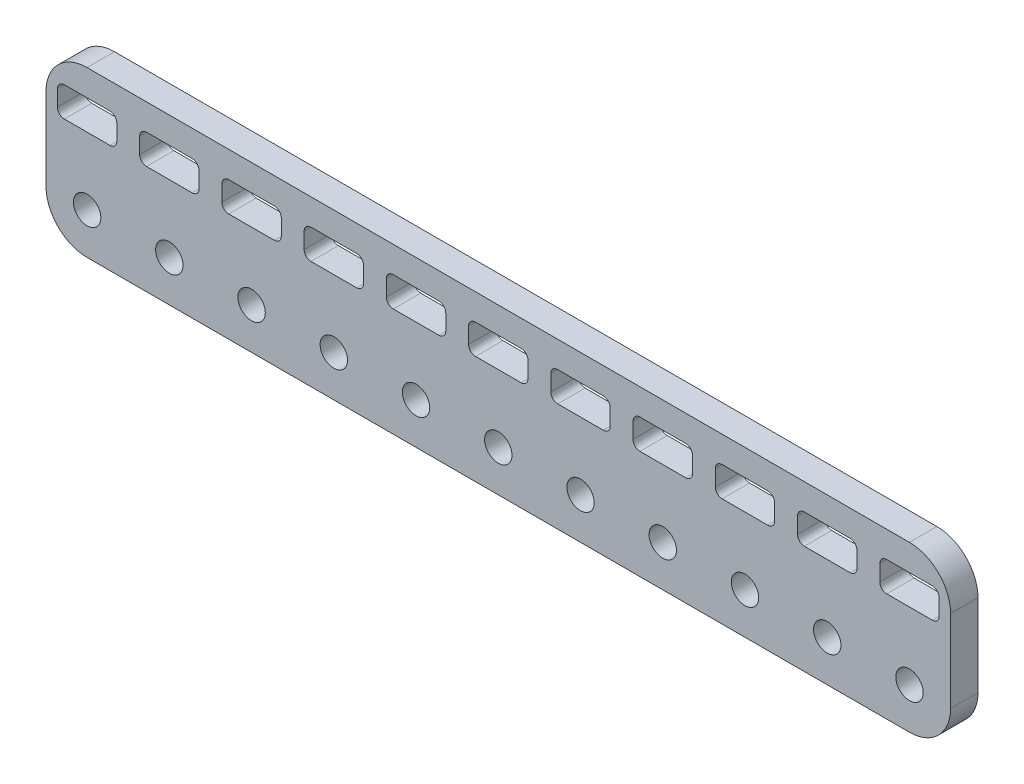
from build123d import *

# Parameters (mm, degrees)
MODEL_R                 = 1.5
SALIENTE_EXTRUIR1_DEPTH = 3


with BuildPart() as part:
    # Model → Saliente-Extruir1 (new body)
    with BuildSketch(Plane.XY):
        with BuildLine():
            Line((256.429131311, 228.742243614), (346.429131311, 228.742243614))
            ThreePointArc((346.429131311, 228.742243614), (349.611111826, 227.424224129), (350.929131311, 224.242243614))
            Line((350.929131311, 224.242243614), (350.929131311, 215.242243614))
            ThreePointArc((350.929131311, 215.242243614), (349.611111826, 212.060263099), (346.429131311, 210.742243614))
            Line((346.429131311, 210.742243614), (256.429131311, 210.742243614))
            ThreePointArc((256.429131311, 210.742243614), (253.247150795, 212.060263099), (251.929131311, 215.242243614))
            Line((251.929131311, 215.242243614), (251.929131311, 224.242243614))
            ThreePointArc((251.929131311, 224.242243614), (253.247150795, 227.424224129), (256.429131311, 228.742243614))
        make_face()
        with Locations((337.429131311, 215.242243614)):
            Circle(MODEL_R, mode=Mode.SUBTRACT)
        with Locations((319.429131311, 215.242243614)):
            Circle(MODEL_R, mode=Mode.SUBTRACT)
        with Locations((328.429131311, 215.242243614)):
            Circle(MODEL_R, mode=Mode.SUBTRACT)
        with Locations((310.429131311, 215.242243614)):
            Circle(MODEL_R, mode=Mode.SUBTRACT)
        with Locations((292.429131311, 215.242243614)):
            Circle(MODEL_R, mode=Mode.SUBTRACT)
        with Locations((301.429131311, 215.242243614)):
            Circle(MODEL_R, mode=Mode.SUBTRACT)
        with Locations((274.429131311, 215.242243614)):
            Circle(MODEL_R, mode=Mode.SUBTRACT)
        with Locations((283.429131311, 215.242243614)):
            Circle(MODEL_R, mode=Mode.SUBTRACT)
        with Locations((265.429131311, 215.242243614)):
            Circle(MODEL_R, mode=Mode.SUBTRACT)
        with Locations((256.429131311, 215.242243614)):
            Circle(MODEL_R, mode=Mode.SUBTRACT)
        with Locations((346.429131311, 215.242243614)):
            Circle(MODEL_R, mode=Mode.SUBTRACT)
        with BuildLine():
            Line((267.929131311, 222.617243614), (262.929131311, 222.617243614))
            ThreePointArc((262.929131311, 222.617243614), (262.398801225, 222.836913528), (262.179131311, 223.367243614))
            Line((262.179131311, 223.367243614), (262.179131311, 225.117243614))
            ThreePointArc((262.179131311, 225.117243614), (262.398801225, 225.6475737), (262.929131311, 225.867243614))
            Line((262.929131311, 225.867243614), (267.929131311, 225.867243614))
            ThreePointArc((267.929131311, 225.867243614), (268.459461397, 225.6475737), (268.679131311, 225.117243614))
            Line((268.679131311, 225.117243614), (268.679131311, 223.367243614))
            ThreePointArc((268.679131311, 223.367243614), (268.459461397, 222.836913528), (267.929131311, 222.617243614))
        make_face(mode=Mode.SUBTRACT)
        with BuildLine():
            Line((285.929131311, 222.617243614), (280.929131311, 222.617243614))
            ThreePointArc((280.929131311, 222.617243614), (280.398801225, 222.836913528), (280.179131311, 223.367243614))
            Line((280.179131311, 223.367243614), (280.179131311, 225.117243614))
            ThreePointArc((280.179131311, 225.117243614), (280.398801225, 225.6475737), (280.929131311, 225.867243614))
            Line((280.929131311, 225.867243614), (285.929131311, 225.867243614))
            ThreePointArc((285.929131311, 225.867243614), (286.459461397, 225.6475737), (286.679131311, 225.117243614))
            Line((286.679131311, 225.117243614), (286.679131311, 223.367243614))
            ThreePointArc((286.679131311, 223.367243614), (286.459461397, 222.836913528), (285.929131311, 222.617243614))
        make_face(mode=Mode.SUBTRACT)
        with BuildLine():
            Line((276.929131311, 222.617243614), (271.929131311, 222.617243614))
            ThreePointArc((271.929131311, 222.617243614), (271.398801225, 222.836913528), (271.179131311, 223.367243614))
            Line((271.179131311, 223.367243614), (271.179131311, 225.117243614))
            ThreePointArc((271.179131311, 225.117243614), (271.398801225, 225.6475737), (271.929131311, 225.867243614))
            Line((271.929131311, 225.867243614), (276.929131311, 225.867243614))
            ThreePointArc((276.929131311, 225.867243614), (277.459461397, 225.6475737), (277.679131311, 225.117243614))
            Line((277.679131311, 225.117243614), (277.679131311, 223.367243614))
            ThreePointArc((277.679131311, 223.367243614), (277.459461397, 222.836913528), (276.929131311, 222.617243614))
        make_face(mode=Mode.SUBTRACT)
        with BuildLine():
            Line((294.929131311, 222.617243614), (289.929131311, 222.617243614))
            ThreePointArc((289.929131311, 222.617243614), (289.398801225, 222.836913528), (289.179131311, 223.367243614))
            Line((289.179131311, 223.367243614), (289.179131311, 225.117243614))
            ThreePointArc((289.179131311, 225.117243614), (289.398801225, 225.6475737), (289.929131311, 225.867243614))
            Line((289.929131311, 225.867243614), (294.929131311, 225.867243614))
            ThreePointArc((294.929131311, 225.867243614), (295.459461397, 225.6475737), (295.679131311, 225.117243614))
            Line((295.679131311, 225.117243614), (295.679131311, 223.367243614))
            ThreePointArc((295.679131311, 223.367243614), (295.459461397, 222.836913528), (294.929131311, 222.617243614))
        make_face(mode=Mode.SUBTRACT)
        with BuildLine():
            Line((303.929131311, 222.617243614), (298.929131311, 222.617243614))
            ThreePointArc((298.929131311, 222.617243614), (298.398801225, 222.836913528), (298.179131311, 223.367243614))
            Line((298.179131311, 223.367243614), (298.179131311, 225.117243614))
            ThreePointArc((298.179131311, 225.117243614), (298.398801225, 225.6475737), (298.929131311, 225.867243614))
            Line((298.929131311, 225.867243614), (303.929131311, 225.867243614))
            ThreePointArc((303.929131311, 225.867243614), (304.459461397, 225.6475737), (304.679131311, 225.117243614))
            Line((304.679131311, 225.117243614), (304.679131311, 223.367243614))
            ThreePointArc((304.679131311, 223.367243614), (304.459461397, 222.836913528), (303.929131311, 222.617243614))
        make_face(mode=Mode.SUBTRACT)
        with BuildLine():
            Line((321.929131311, 222.617243614), (316.929131311, 222.617243614))
            ThreePointArc((316.929131311, 222.617243614), (316.398801225, 222.836913528), (316.179131311, 223.367243614))
            Line((316.179131311, 223.367243614), (316.179131311, 225.117243614))
            ThreePointArc((316.179131311, 225.117243614), (316.398801225, 225.6475737), (316.929131311, 225.867243614))
            Line((316.929131311, 225.867243614), (321.929131311, 225.867243614))
            ThreePointArc((321.929131311, 225.867243614), (322.459461397, 225.6475737), (322.679131311, 225.117243614))
            Line((322.679131311, 225.117243614), (322.679131311, 223.367243614))
            ThreePointArc((322.679131311, 223.367243614), (322.459461397, 222.836913528), (321.929131311, 222.617243614))
        make_face(mode=Mode.SUBTRACT)
        with BuildLine():
            Line((312.929131311, 222.617243614), (307.929131311, 222.617243614))
            ThreePointArc((307.929131311, 222.617243614), (307.398801225, 222.836913528), (307.179131311, 223.367243614))
            Line((307.179131311, 223.367243614), (307.179131311, 225.117243614))
            ThreePointArc((307.179131311, 225.117243614), (307.398801225, 225.6475737), (307.929131311, 225.867243614))
            Line((307.929131311, 225.867243614), (312.929131311, 225.867243614))
            ThreePointArc((312.929131311, 225.867243614), (313.459461397, 225.6475737), (313.679131311, 225.117243614))
            Line((313.679131311, 225.117243614), (313.679131311, 223.367243614))
            ThreePointArc((313.679131311, 223.367243614), (313.459461397, 222.836913528), (312.929131311, 222.617243614))
        make_face(mode=Mode.SUBTRACT)
        with BuildLine():
            Line((258.929131311, 222.617243614), (253.929131311, 222.617243614))
            ThreePointArc((253.929131311, 222.617243614), (253.398801225, 222.836913528), (253.179131311, 223.367243614))
            Line((253.179131311, 223.367243614), (253.179131311, 225.117243614))
            ThreePointArc((253.179131311, 225.117243614), (253.398801225, 225.6475737), (253.929131311, 225.867243614))
            Line((253.929131311, 225.867243614), (258.929131311, 225.867243614))
            ThreePointArc((258.929131311, 225.867243614), (259.459461397, 225.6475737), (259.679131311, 225.117243614))
            Line((259.679131311, 225.117243614), (259.679131311, 223.367243614))
            ThreePointArc((259.679131311, 223.367243614), (259.459461397, 222.836913528), (258.929131311, 222.617243614))
        make_face(mode=Mode.SUBTRACT)
        with BuildLine():
            Line((348.929131311, 222.617243614), (343.929131311, 222.617243614))
            ThreePointArc((343.929131311, 222.617243614), (343.398801225, 222.836913528), (343.179131311, 223.367243614))
            Line((343.179131311, 223.367243614), (343.179131311, 225.117243614))
            ThreePointArc((343.179131311, 225.117243614), (343.398801225, 225.6475737), (343.929131311, 225.867243614))
            Line((343.929131311, 225.867243614), (348.929131311, 225.867243614))
            ThreePointArc((348.929131311, 225.867243614), (349.459461397, 225.6475737), (349.679131311, 225.117243614))
            Line((349.679131311, 225.117243614), (349.679131311, 223.367243614))
            ThreePointArc((349.679131311, 223.367243614), (349.459461397, 222.836913528), (348.929131311, 222.617243614))
        make_face(mode=Mode.SUBTRACT)
        with BuildLine():
            Line((339.929131311, 222.617243614), (334.929131311, 222.617243614))
            ThreePointArc((334.929131311, 222.617243614), (334.398801225, 222.836913528), (334.179131311, 223.367243614))
            Line((334.179131311, 223.367243614), (334.179131311, 225.117243614))
            ThreePointArc((334.179131311, 225.117243614), (334.398801225, 225.6475737), (334.929131311, 225.867243614))
            Line((334.929131311, 225.867243614), (339.929131311, 225.867243614))
            ThreePointArc((339.929131311, 225.867243614), (340.459461397, 225.6475737), (340.679131311, 225.117243614))
            Line((340.679131311, 225.117243614), (340.679131311, 223.367243614))
            ThreePointArc((340.679131311, 223.367243614), (340.459461397, 222.836913528), (339.929131311, 222.617243614))
        make_face(mode=Mode.SUBTRACT)
        with BuildLine():
            Line((330.929131311, 222.617243614), (325.929131311, 222.617243614))
            ThreePointArc((325.929131311, 222.617243614), (325.398801225, 222.836913528), (325.179131311, 223.367243614))
            Line((325.179131311, 223.367243614), (325.179131311, 225.117243614))
            ThreePointArc((325.179131311, 225.117243614), (325.398801225, 225.6475737), (325.929131311, 225.867243614))
            Line((325.929131311, 225.867243614), (330.929131311, 225.867243614))
            ThreePointArc((330.929131311, 225.867243614), (331.459461397, 225.6475737), (331.679131311, 225.117243614))
            Line((331.679131311, 225.117243614), (331.679131311, 223.367243614))
            ThreePointArc((331.679131311, 223.367243614), (331.459461397, 222.836913528), (330.929131311, 222.617243614))
        make_face(mode=Mode.SUBTRACT)
    extrude(amount=SALIENTE_EXTRUIR1_DEPTH)


solid = part.part
